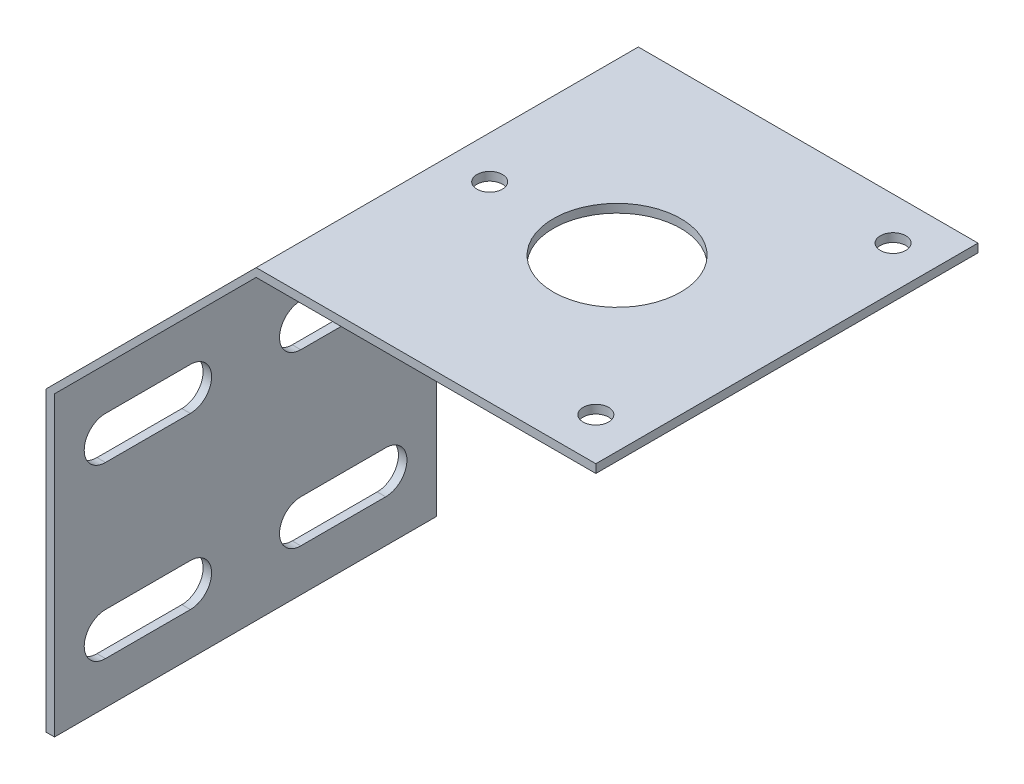
from build123d import *

# Parameters (mm, degrees)
BOSS_EXTRUDE1_DEPTH = 90
SKETCH2_R           = 15
SKETCH2_R_2         = 3
CUT_EXTRUDE1_DEPTH  = 2
CUT_EXTRUDE2_DEPTH  = 2


with BuildPart() as part:
    # Sketch1 → Boss-Extrude1 (new body)
    with BuildSketch(Plane.XY):
        Polygon((0, 0), (0, 70), (49.497474683, 119.497474683), (129.497474683, 119.497474683), (129.497474683, 117.497474683), (49.497474683, 117.497474683), (2, 70), (2, 0), align=None)
    extrude(amount=BOSS_EXTRUDE1_DEPTH)

    # Sketch2 → Cut-Extrude1 (cut)
    with BuildSketch(Plane(origin=(0, 119.497474683, 0), x_dir=(1, 0, 0), z_dir=(0, 1, 0))):
        with Locations(Location((89.497474683, -45, 0), (0, 0, 270))):
            Circle(SKETCH2_R)
        with Locations(Location((59.497474683, -45, 0), (0, 0, 270))):
            Circle(SKETCH2_R_2)
        with Locations(Location((119.497474683, -10, 0), (0, 0, 270))):
            Circle(SKETCH2_R_2)
        with Locations(Location((119.497474683, -80, 0), (0, 0, 270))):
            Circle(SKETCH2_R_2)
    extrude(amount=-CUT_EXTRUDE1_DEPTH, mode=Mode.SUBTRACT)

    # Sketch3 → Cut-Extrude2 (cut)
    with BuildSketch(Plane.ZY):
        with BuildLine():
            Line((12, 60), (32, 60))
            ThreePointArc((32, 60), (37, 55), (32, 50))
            Line((32, 50), (12, 50))
            ThreePointArc((12, 50), (7, 55), (12, 60))
        make_face()
        with BuildLine():
            Line((58, 20), (78, 20))
            ThreePointArc((78, 20), (83, 15), (78, 10))
            Line((78, 10), (58, 10))
            ThreePointArc((58, 10), (53, 15), (58, 20))
        make_face()
        with BuildLine():
            Line((58, 60), (78, 60))
            ThreePointArc((78, 60), (83, 55), (78, 50))
            Line((78, 50), (58, 50))
            ThreePointArc((58, 50), (53, 55), (58, 60))
        make_face()
        with BuildLine():
            Line((12, 20), (32, 20))
            ThreePointArc((32, 20), (37, 15), (32, 10))
            Line((32, 10), (12, 10))
            ThreePointArc((12, 10), (7, 15), (12, 20))
        make_face()
    extrude(amount=-CUT_EXTRUDE2_DEPTH, mode=Mode.SUBTRACT)


solid = part.part
